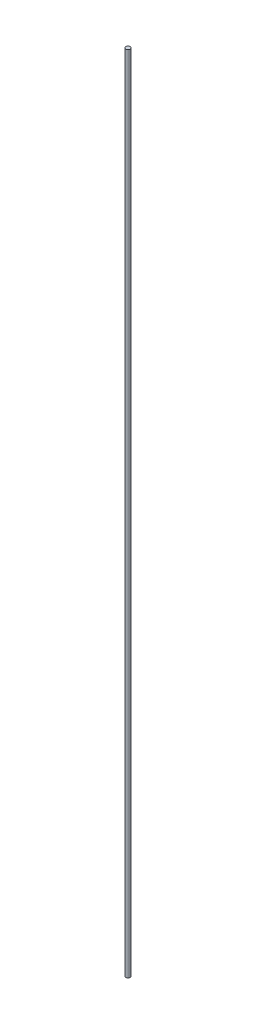
from build123d import *

# Parameters (mm, degrees)
SKETCH1_R           = 0.1
BOSS_EXTRUDE1_DEPTH = 36


with BuildPart() as part:
    # Sketch1 → Boss-Extrude1 (new body)
    with BuildSketch(Plane(origin=(0, 0, 0), x_dir=(1, 0, 0), z_dir=(0, 1, 0))):
        with Locations(Location((0, 0, 0), (0, 0, 270))):
            Circle(SKETCH1_R)
    extrude(amount=BOSS_EXTRUDE1_DEPTH)


solid = part.part
